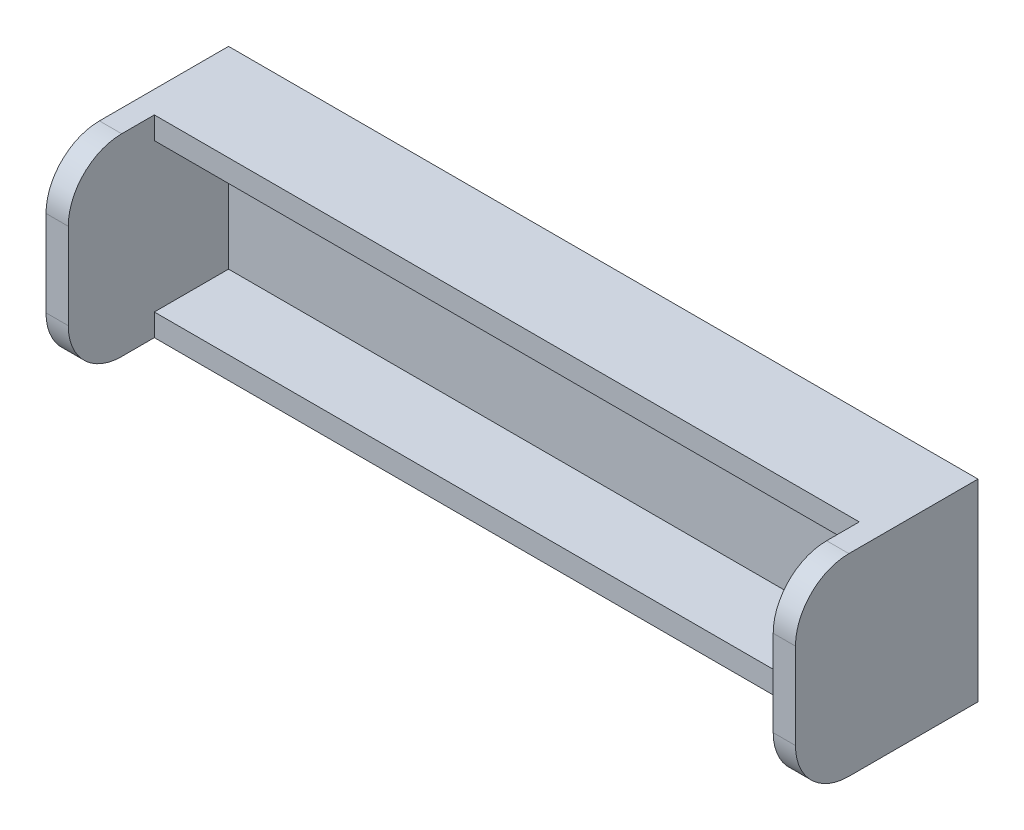
from build123d import *

# Parameters (mm, degrees)
BOSS_EXTRUDE1_DEPTH = 1.5
LPATTERN1_COUNT     = 2
LPATTERN1_PITCH     = 49
SKETCH2_W           = 50.5
SKETCH2_H           = 13
BOSS_EXTRUDE2_DEPTH = 1.5
SKETCH3_W           = 50.5
SKETCH3_H           = 6.5
BOSS_EXTRUDE3_DEPTH = 1.5


with BuildPart() as part:
    # Sketch1 → Boss-Extrude1 (new body)
    with BuildSketch(Plane(origin=(0, 0, 0), x_dir=(0, 0, -1), z_dir=(1, 0, 0))):
        with BuildLine():
            Line((0, 6.5), (0, -6.5))
            Line((0, -6.5), (-8.7, -6.5))
            ThreePointArc((-8.7, -6.5), (-11.245584412, -5.445584412), (-12.3, -2.9))
            Line((-12.3, -2.9), (-12.3, 2.9))
            ThreePointArc((-12.3, 2.9), (-11.245584412, 5.445584412), (-8.7, 6.5))
            Line((-8.7, 6.5), (0, 6.5))
        make_face()
    extrude(amount=BOSS_EXTRUDE1_DEPTH)


with BuildPart() as lpattern1_1:
    # LPattern1: pattern copy
    add(part.part.moved(Location(Vector(1, 0, 0) * (1 * LPATTERN1_PITCH))))


with BuildPart() as part_1:
    add(part.part)

    add(lpattern1_1.part)  # Boss-Extrude2 merges LPattern1_1
    # Sketch2 → Boss-Extrude2 (add)
    with BuildSketch(Plane.XY):
        with Locations((25.25, 0)):
            Rectangle(SKETCH2_W, SKETCH2_H)
    extrude(amount=BOSS_EXTRUDE2_DEPTH)

    # Sketch3 → Boss-Extrude3 (add)
    with BuildSketch(Plane.XZ.offset(6.5)):
        with Locations((25.25, 3.25)):
            Rectangle(SKETCH3_W, SKETCH3_H)
    boss_extrude3 = extrude(amount=-BOSS_EXTRUDE3_DEPTH)

    # Mirror1: Boss-Extrude3 across plane
    add(boss_extrude3.mirror(Plane.ZX))


solid = part_1.part
